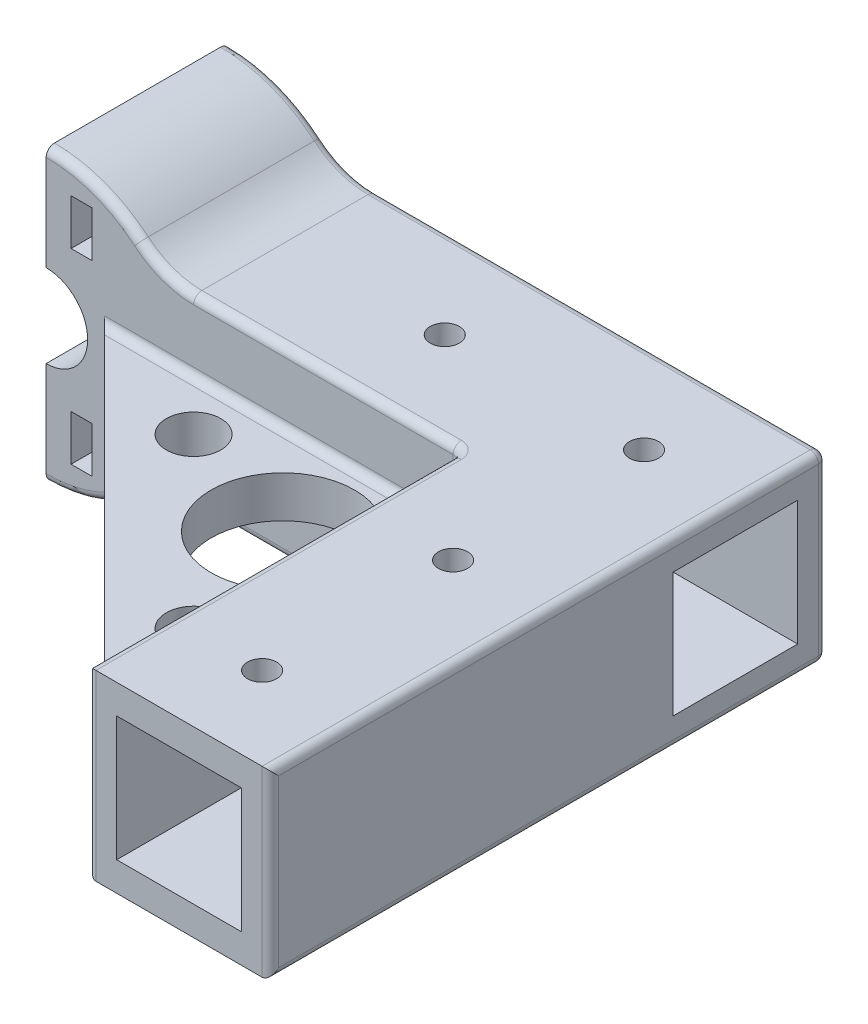
from build123d import *

# Parameters (mm, degrees)
BOSS_EXTRUDE1_DEPTH      = 22
SKETCH2_W                = 22
SKETCH2_H                = 22
BOSS_EXTRUDE2_DEPTH      = 45
SKETCH3_W                = 15
SKETCH3_H                = 15
CUT_EXTRUDE1_DEPTH       = 43
SKETCH4_W                = 15
SKETCH4_H                = 15
CUT_EXTRUDE2_DEPTH       = 45
BOSS_EXTRUDE3_DEPTH      = 2.5
BOSS_EXTRUDE3_DEPTH_BACK = 2.5
FILLET1_R                = 10
SKETCH5_R                = 1.75
CUT_EXTRUDE3_DEPTH       = 8
CUT_EXTRUDE5_START       = -22
SKETCH8_R                = 1.75
CUT_EXTRUDE5_DEPTH       = 22
SKETCH9_W                = 4.563380282
SKETCH9_H                = 3.718309859
CUT_EXTRUDE6_DEPTH       = 1.5
SKETCH10_R               = 8.636857144
SKETCH10_R_2             = 3.280749897
CUT_EXTRUDE7_DEPTH       = 5
FILLET2_R                = 1
SKETCH11_W               = 2.5
SKETCH11_H               = 5.5
CUT_EXTRUDE8_DEPTH       = 12
CUT_EXTRUDE9_DEPTH       = 2.5


with BuildPart() as part:
    # Sketch1 → Boss-Extrude1 (new body)
    with BuildSketch(Plane.XY):
        with BuildLine():
            Line((5.170578839, 4.123318258), (63.55992125, 4.123318258))
            Line((63.55992125, 4.123318258), (63.55992125, -17.876681742))
            Line((63.55992125, -17.876681742), (5.170578839, -17.876681742))
            ThreePointArc((5.170578839, -17.876681742), (-0.898527186, -22.66829344), (-8.44007875, -24.376681742))
            Line((-8.44007875, -24.376681742), (-8.44007875, -14.35565445))
            Line((-8.44007875, -14.35565445), (-8.44007875, -11.876681742))
            ThreePointArc((-8.44007875, -11.876681742), (-3.44007875, -6.876681742), (-8.44007875, -1.876681742))
            Line((-8.44007875, -1.876681742), (-8.44007875, 7.64434555))
            Line((-8.44007875, 7.64434555), (-8.44007875, 10.623318258))
            ThreePointArc((-8.44007875, 10.623318258), (-0.898527186, 8.914929955), (5.170578839, 4.123318258))
        make_face()
    extrude(amount=BOSS_EXTRUDE1_DEPTH)

    # Sketch2 → Boss-Extrude2 (add)
    with BuildSketch(Plane.XY.offset(22)):
        with Locations((52.55992125, -6.876681742)):
            Rectangle(SKETCH2_W, SKETCH2_H)
    extrude(amount=BOSS_EXTRUDE2_DEPTH)

    # Sketch3 → Cut-Extrude1 (cut)
    with BuildSketch(Plane.XY.offset(67)):
        with Locations((52.55992125, -6.876681742)):
            Rectangle(SKETCH3_W, SKETCH3_H)
    extrude(amount=-CUT_EXTRUDE1_DEPTH, mode=Mode.SUBTRACT)

    # Sketch4 → Cut-Extrude2 (cut)
    with BuildSketch(Plane(origin=(63.55992125, 0, 0), x_dir=(0, 0, -1), z_dir=(1, 0, 0))):
        with Locations((-11, -6.876681742)):
            Rectangle(SKETCH4_W, SKETCH4_H)
    extrude(amount=-CUT_EXTRUDE2_DEPTH, mode=Mode.SUBTRACT)

    # Sketch6 → Boss-Extrude3 (add, two sides: drawn at the far end of the back side and taken through both)
    with BuildSketch(Plane(origin=(0, -6.876681742, 0), x_dir=(1, 0, 0), z_dir=(0, 1, 0)).offset(-BOSS_EXTRUDE3_DEPTH_BACK)):
        Polygon((-1.44007875, -22), (41.55992125, -65), (41.55992125, -22), align=None)
    extrude(amount=BOSS_EXTRUDE3_DEPTH + BOSS_EXTRUDE3_DEPTH_BACK)

    # Fillet1
    fillet1_edges = [part.edges().sort_by_distance(p)[0] for p in [
        (5.170578839, -17.876681742, 11),
        (5.170578839, 4.123318258, 11),
    ]]
    fillet(fillet1_edges, radius=FILLET1_R)

    # Sketch5 → Cut-Extrude3 (cut)
    with BuildSketch(Plane.ZY.offset(8.44007875)):
        with Locations((11, 4.373318258)):
            Circle(SKETCH5_R)
        with Locations((11, -18.126681742)):
            Circle(SKETCH5_R)
    extrude(amount=-CUT_EXTRUDE3_DEPTH, mode=Mode.SUBTRACT)

    # Sketch8 → Cut-Extrude5 (cut)
    with BuildSketch(Plane.XZ.offset(17.876681742).offset(CUT_EXTRUDE5_START)):
        with Locations((28.55992125, 11)):
            Circle(SKETCH8_R)
        with Locations((52.55992125, 11)):
            Circle(SKETCH8_R)
        with Locations(Location((52.55992125, 34, 0), (0, 0, 270))):
            Circle(SKETCH8_R)
        with Locations(Location((52.55992125, 57, 0), (0, 0, 270))):
            Circle(SKETCH8_R)
    extrude(amount=CUT_EXTRUDE5_DEPTH, mode=Mode.SUBTRACT)

    # Sketch9 → Cut-Extrude6 (cut)
    # profile 1 of 6: a face of its own
    with BuildSketch(Plane(origin=(0, 0, 0), x_dir=(-1, 0, 0), z_dir=(0, 0, -1))):
        Polygon((-53.489498715, -1.045695827), (-52.94020294, -1.853794418), (-52.94020294, -12.876681742), (-54.26854801, -12.876681742), (-54.79935787, -12.118759207), (-54.79935787, -8.989357799), (-59.048477588, -8.989357799), (-59.362738151, -9.472632447), (-59.362738151, -12.068583151), (-59.927878996, -12.876681742), (-60.691083222, -12.876681742), (-61.221893081, -12.124040897), (-61.221893081, -8.822984559), (-55.958688855, -1.045695827), align=None)
        Polygon((-55.248301532, -3.242878925), (-57.691083222, -6.7921747), (-54.79935787, -6.7921747), (-54.79935787, -3.242878925), align=None, mode=Mode.SUBTRACT)
    # profile 2 of 6: a face of its own
    with BuildSketch(Plane(origin=(0, 0, 0), x_dir=(-1, 0, 0), z_dir=(0, 0, -1))):
        Polygon((-50.950590264, -0.961188785), (-50.446188855, -0.876681742), (-49.88104801, -1.695343714), (-49.88104801, -10.679498644), (-45.317667729, -10.679498644), (-45.317667729, -9.506963432), (-44.784217024, -8.746400052), (-44.026294489, -8.746400052), (-43.458512799, -9.557139489), (-43.458512799, -12.876681742), (-51.230519841, -12.876681742), (-51.74020294, -12.116118362), (-51.74020294, -1.639885968), (-51.021893081, -0.998160616), align=None)
    # profile 3 of 6: a face of its own
    with BuildSketch(Plane(origin=(0, 0, 0), x_dir=(-1, 0, 0), z_dir=(0, 0, -1))):
        Polygon((-34.011153644, -2.289533855), (-34.549886039, -3.073864841), (-40.39935787, -3.073864841), (-40.39935787, -6.7921747), (-34.549886039, -6.7921747), (-34.011153644, -7.579146531), (-34.011153644, -8.205026813), (-34.549886039, -8.989357799), (-40.39935787, -8.989357799), (-40.39935787, -12.068583151), (-40.964498715, -12.876681742), (-41.72770294, -12.876681742), (-42.258512799, -12.116118362), (-42.258512799, -1.639885968), (-41.725062095, -0.876681742), (-34.549886039, -0.876681742), (-34.011153644, -1.663653573), align=None)
    # profile 4 of 6: a face of its own
    with BuildSketch(Plane(origin=(0, 0, 0), x_dir=(-1, 0, 0), z_dir=(0, 0, -1))):
        Polygon((-32.26713956, -0.876681742), (-25.036505757, -0.876681742), (-24.495132517, -1.690062024), (-24.495132517, -8.181259207), (-25.033864912, -8.989357799), (-27.085801532, -8.989357799), (-24.495132517, -12.876681742), (-26.64213956, -12.876681742), (-29.209040968, -8.989357799), (-30.917667729, -8.989357799), (-30.917667729, -12.068583151), (-31.482808574, -12.876681742), (-32.246012799, -12.876681742), (-32.776822658, -12.116118362), (-32.776822658, -1.639885968), align=None)
        with Locations((-28.635977588, -4.933019771)):
            Rectangle(SKETCH9_W, SKETCH9_H, mode=Mode.SUBTRACT)
    # profile 5 of 6: a face of its own
    with BuildSketch(Plane(origin=(0, 0, 0), x_dir=(-1, 0, 0), z_dir=(0, 0, -1))):
        Polygon((-23.295132517, -12.087069066), (-23.295132517, -10.848512728), (-23.295132517, -9.506963432), (-22.761681813, -8.746400052), (-22.003759278, -8.746400052), (-21.435977588, -9.557139489), (-21.435977588, -10.679498644), (-16.872597306, -10.679498644), (-16.872597306, -6.961188785), (-22.788090264, -6.961188785), (-23.295132517, -6.2296747), (-23.295132517, -5.500801461), (-22.788090264, -4.764005686), (-16.872597306, -4.764005686), (-16.872597306, -3.073864841), (-22.788090264, -3.073864841), (-23.295132517, -2.342350756), (-23.295132517, -1.613477517), (-22.780167729, -0.876681742), (-15.554815616, -0.876681742), (-15.013442377, -1.690062024), (-15.013442377, -12.876681742), (-15.784569137, -12.876681742), (-22.782808574, -12.876681742), (-23.028407165, -12.137245123), align=None)
    # profile 6 of 6: a face of its own
    with BuildSketch(Plane(origin=(0, 0, 0), x_dir=(-1, 0, 0), z_dir=(0, 0, -1))):
        Polygon((-13.303759278, -0.876681742), (-10.824005757, -0.876681742), (-5.531752236, -8.817702869), (-5.531752236, -12.876681742), (-6.302878996, -12.876681742), (-13.303759278, -12.876681742), (-13.813442377, -12.116118362), (-13.813442377, -1.639885968), align=None)
        Polygon((-11.539674771, -3.073864841), (-11.954287447, -3.073864841), (-11.954287447, -10.679498644), (-7.390907165, -10.679498644), (-7.390907165, -9.575625404), align=None, mode=Mode.SUBTRACT)
    extrude(amount=-CUT_EXTRUDE6_DEPTH, mode=Mode.SUBTRACT)

    # Sketch10 → Cut-Extrude7 (cut)
    with BuildSketch(Plane.XZ.offset(9.376681742)):
        with Locations(Location((30.80992125, 32.75, 0), (0, 0, 270))):
            Circle(SKETCH10_R)
        with Locations(Location((35.55992125, 48.25, 0), (0, 0, 270))):
            Circle(SKETCH10_R_2)
        with Locations(Location((15.30992125, 28, 0), (0, 0, 270))):
            Circle(SKETCH10_R_2)
    extrude(amount=-CUT_EXTRUDE7_DEPTH, mode=Mode.SUBTRACT)

    # Fillet2
    fillet2_edges = [part.edges().sort_by_distance(p)[0] for p in [
        (63.55992125, -6.876681742, 0),
        (-2.424001804, -23.310087299, 0),
        (63.55992125, 4.123318258, 33.5),
        (63.55992125, -17.876681742, 33.5),
        (-2.424001804, -23.310087299, 22),
        (25.437561702, 4.123318258, 22),
        (41.55992125, -0.126681742, 22),
        (41.55992125, 4.123318258, 44.5),
        (41.55992125, -17.876681742, 44.5),
        (63.55992125, -6.876681742, 67),
        (41.55992125, -6.876681742, 67),
        (41.55992125, -13.626681742, 22),
        (20.05992125, -9.376681742, 22),
        (41.55992125, -9.376681742, 43.5),
        (20.05992125, -4.376681742, 22),
        (41.55992125, -4.376681742, 43.5),
        (36.437561702, -17.876681742, 0),
        (25.437561702, -17.876681742, 22),
        (-2.424001804, 9.556723814, 0),
        (-2.424001804, 9.556723814, 22),
        (5.8774439, -18.486164282, 0),
        (5.8774439, -18.486164282, 22),
        (5.8774439, 4.732800797, 0),
        (5.8774439, 4.732800797, 22),
        (36.437561702, 4.123318258, 0),
    ]]
    fillet(fillet2_edges, radius=FILLET2_R)

    # Sketch11 → Cut-Extrude8 (cut)
    with BuildSketch(Plane.XY.offset(22)):
        with Locations((-4.19007875, 4.373318258)):
            Rectangle(SKETCH11_W, SKETCH11_H)
        with Locations((-4.19007875, -18.126681742)):
            Rectangle(SKETCH11_W, SKETCH11_H)
    extrude(amount=-CUT_EXTRUDE8_DEPTH, mode=Mode.SUBTRACT)

    # Sketch12 → Cut-Extrude9 (cut)
    with BuildSketch(Plane.ZY.offset(2.94007875)):
        Polygon((8.91228676, -20.876681742), (12.08771324, -20.876681742), (13.675426481, -18.126681742), (12.08771324, -15.376681742), (8.91228676, -15.376681742), (7.324573519, -18.126681742), align=None)
        Polygon((12.08771324, 7.123318258), (8.91228676, 7.123318258), (7.324573519, 4.373318258), (8.91228676, 1.623318258), (12.08771324, 1.623318258), (13.675426481, 4.373318258), align=None)
    extrude(amount=CUT_EXTRUDE9_DEPTH, mode=Mode.SUBTRACT)


solid = part.part
